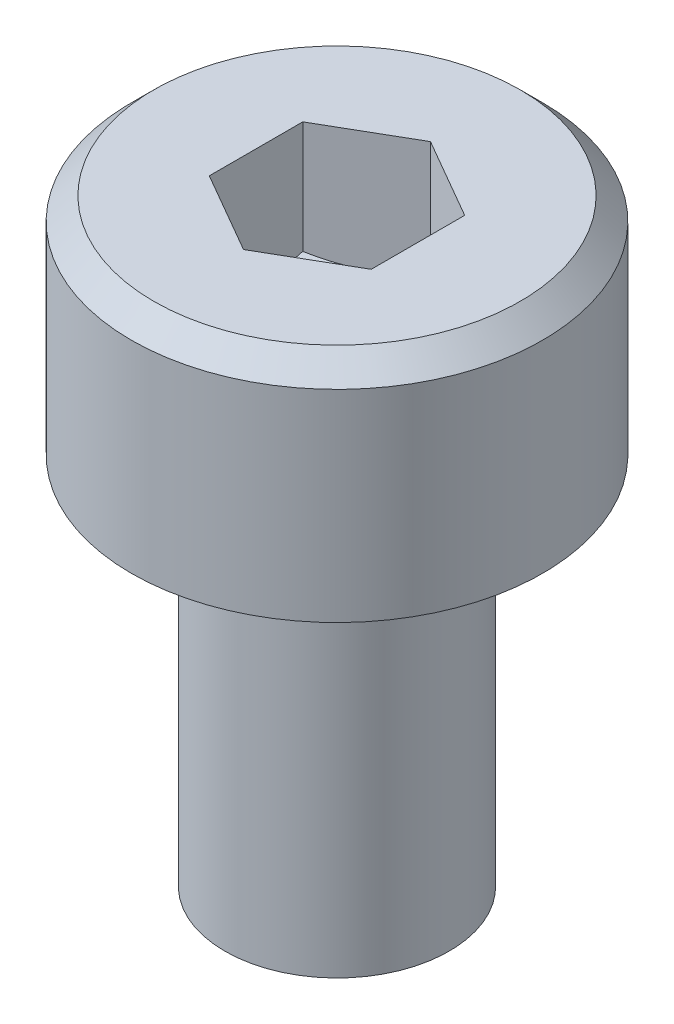
from build123d import *

# Parameters (mm, degrees)
CROQUIS4_R              = 2.75
SALIENTE_EXTRUIR3_DEPTH = 3
CHAFL_N2_SIZE           = 0.3
CROQUIS6_R              = 1.5
SALIENTE_EXTRUIR4_DEPTH = 5


with BuildPart() as part:
    # Croquis4 → Saliente-Extruir3 (new body)
    with BuildSketch(Plane(origin=(0, 0, 0), x_dir=(1, 0, 0), z_dir=(0, 1, 0))):
        Circle(CROQUIS4_R)
        Polygon((0, 1.25), (-1.082531755, 0.625), (-1.082531755, -0.625), (0, -1.25), (1.082531755, -0.625), (1.082531755, 0.625), align=None, mode=Mode.SUBTRACT)
    extrude(amount=SALIENTE_EXTRUIR3_DEPTH)

    # Chaflán2
    chafl_n2_edges = [part.edges().sort_by_distance(p)[0] for p in [
        (-2.75, 3, 0),
    ]]
    chamfer(chafl_n2_edges, length=CHAFL_N2_SIZE)

    # Croquis5 → Revolución2 (revolve)
    with BuildSketch(Plane.XY):
        Polygon((0, 0), (0, 0.778312164), (1.25, 1.5), (2.75, 1.5), (2.75, 0), align=None)
    revolve(axis=Axis((0, 0, 0), (0, 1, 0)))

    # Croquis6 → Saliente-Extruir4 (add)
    with BuildSketch(Plane.XZ):
        Circle(CROQUIS6_R)
    extrude(amount=SALIENTE_EXTRUIR4_DEPTH)


solid = part.part
